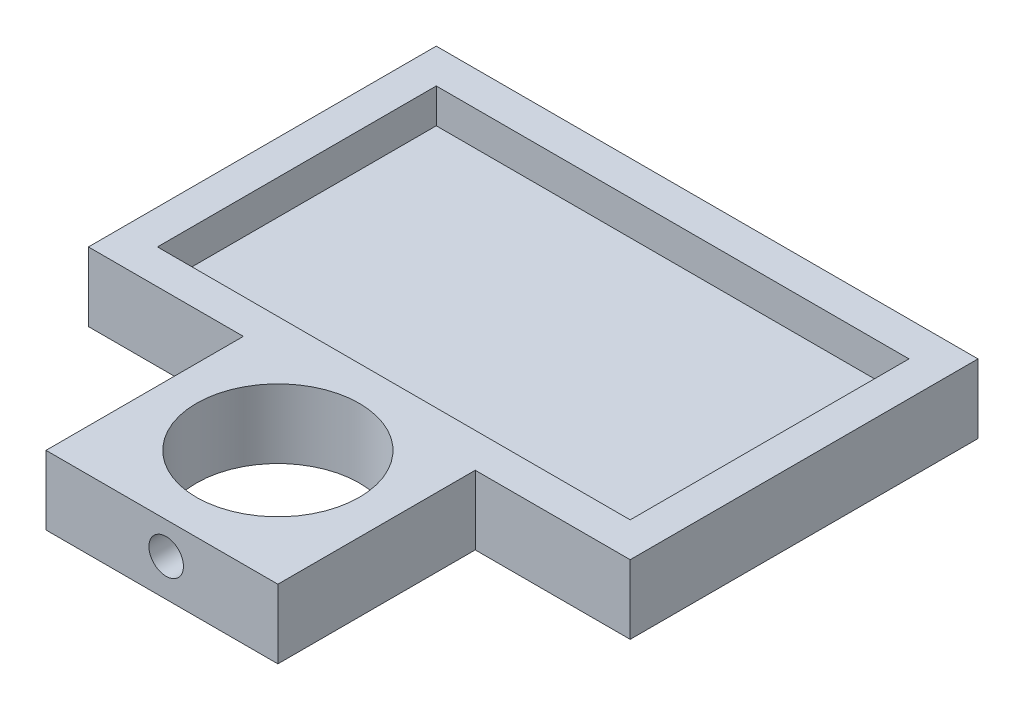
from build123d import *

# Parameters (mm, degrees)
SKETCH2_W                  = 78.5
SKETCH2_H                  = 50.4
BOSS_EXTRUDE2_DEPTH        = 10
SKETCH3_W                  = 68.5
SKETCH3_H                  = 40.4
CUT_EXTRUDE1_DEPTH         = 5
SKETCH6_W                  = 33.6
SKETCH6_H                  = 33.6
SKETCH6_R                  = 11.8
BOSS_EXTRUDE4_DEPTH        = 10
M6X1_0_TAPPED_HOLE5_REACH  = 90.653
M6X1_0_TAPPED_HOLE5_BORE_R = 2.5


with BuildPart() as part:
    # Sketch2 → Boss-Extrude2 (new body)
    with BuildSketch(Plane(origin=(0, 0, 0), x_dir=(1, 0, 0), z_dir=(0, 1, 0))):
        with Locations((-42.320258308, 20.202024982)):
            Rectangle(SKETCH2_W, SKETCH2_H)
    extrude(amount=BOSS_EXTRUDE2_DEPTH)

    # Sketch3 → Cut-Extrude1 (cut)
    with BuildSketch(Plane(origin=(0, 10, 0), x_dir=(1, 0, 0), z_dir=(0, 1, 0))):
        with Locations((-42.320258308, 20.202024982)):
            Rectangle(SKETCH3_W, SKETCH3_H)
    extrude(amount=-CUT_EXTRUDE1_DEPTH, mode=Mode.SUBTRACT)

    # Sketch6 → Boss-Extrude4 (add)
    with BuildSketch(Plane(origin=(0, 10, 0), x_dir=(1, 0, 0), z_dir=(0, 1, 0))):
        with Locations((-42.320258308, -16.797975018)):
            Rectangle(SKETCH6_W, SKETCH6_H)
        with Locations(Location((-42.320258308, -16.797975018, 0), (0, 0, 270))):
            Circle(SKETCH6_R, mode=Mode.SUBTRACT)
    extrude(amount=-BOSS_EXTRUDE4_DEPTH)

    # M6x1.0 Tapped Hole5 bore (on position points) → M6x1.0 Tapped Hole5 (cut, up to next)
    with BuildSketch(Plane(origin=(-41.704543892, 5.39331072, 33.597975018), x_dir=(1, 0, 0), z_dir=(0, 0, 1)), mode=Mode.PRIVATE) as m6x1_0_tapped_hole5_sk1:
        Circle(M6X1_0_TAPPED_HOLE5_BORE_R)
    m6x1_0_tapped_hole5_tool1 = extrude(m6x1_0_tapped_hole5_sk1.sketch, amount=-M6X1_0_TAPPED_HOLE5_REACH, mode=Mode.PRIVATE) & part.part
    add(m6x1_0_tapped_hole5_tool1.solids().sort_by_distance((-41.704544, 5.393311, 33.597975))[0], mode=Mode.SUBTRACT)


solid = part.part
